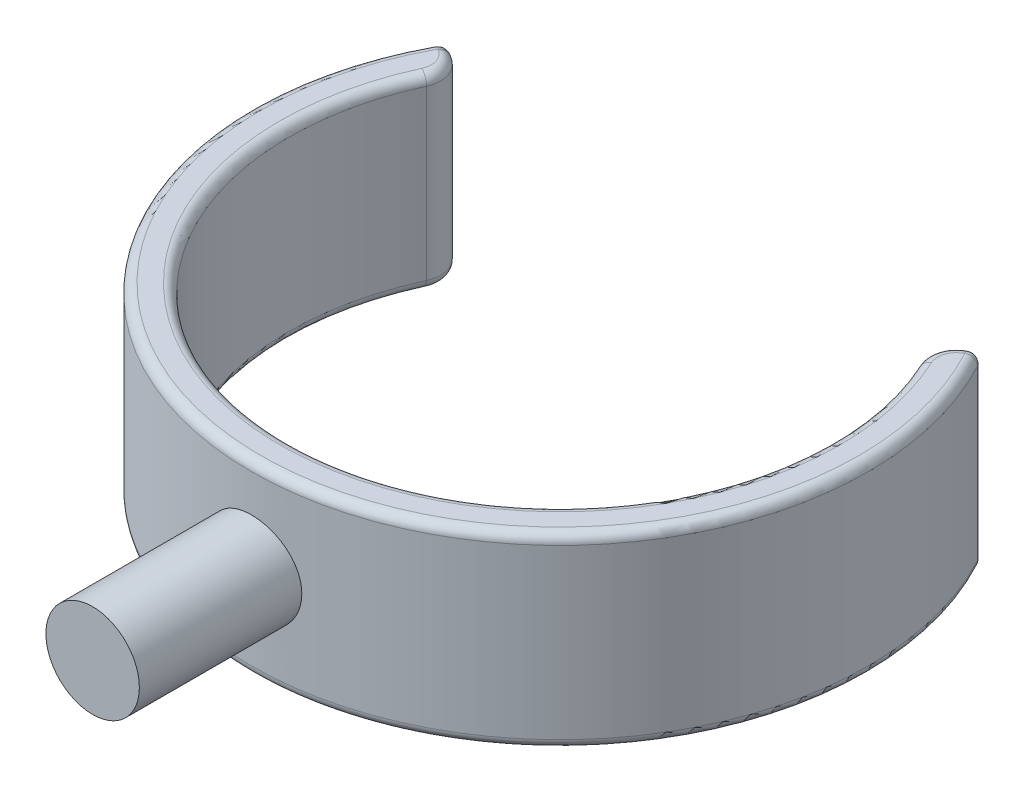
from build123d import *

# Parameters (mm, degrees)
EXTRUIR1_DEPTH      = 20
EXTRUIR2_REACH      = 102.774
EXTRUIR2_END_RADIUS = 33
EXTRUIR2_START      = 50
CROQUIS2_R          = 5
REDONDEO1_R         = 3
REDONDEO2_R         = 1


with BuildPart() as part:
    # Croquis1 → Extruir1 (new body)
    with BuildSketch(Plane(origin=(0, 0, 0), x_dir=(1, 0, 0), z_dir=(0, 1, 0))):
        with BuildLine():
            Line((28.578838325, 16.5), (25.11473671, 14.5))
            ThreePointArc((25.11473671, 14.5), (0, -29), (-25.11473671, 14.5))
            Line((-25.11473671, 14.5), (-28.578838325, 16.5))
            ThreePointArc((-28.578838325, 16.5), (0, -33), (28.578838325, 16.5))
        make_face()
    extrude(amount=EXTRUIR1_DEPTH)

    # Extruir2: up to this cylinder (the profile starts outside it)
    extruir2_end = Plane(origin=(0, 10, 0), z_dir=(0, -1, 0)) * Cylinder(EXTRUIR2_END_RADIUS, 272.548, mode=Mode.PRIVATE)
    # Croquis2 → Extruir2 (add, up to the surface)
    with BuildSketch(Plane.XY.offset(EXTRUIR2_START), mode=Mode.PRIVATE) as extruir2_sk1:
        with Locations((0, 10)):
            Circle(CROQUIS2_R)
    extruir2_tool1 = extrude(extruir2_sk1.sketch, amount=-EXTRUIR2_REACH, mode=Mode.PRIVATE) - extruir2_end
    add(extruir2_tool1.solids().sort_by_distance((0, 10, 50))[0])

    # Redondeo1
    redondeo1_edges = [part.edges().sort_by_distance(p)[0] for p in [
        (25.11473671, 10, -14.5),
        (-25.11473671, 10, -14.5),
    ]]
    fillet(redondeo1_edges, radius=REDONDEO1_R)

    # Redondeo2
    redondeo2_edges = [part.edges().sort_by_distance(p)[0] for p in [
        (0, 20, 33),
        (-28.084798824, 0, -16.214766161),
        (-28.084798824, 20, -16.214766161),
        (0, 0, 29),
        (28.084798824, 0, -16.214766161),
        (26.232610791, 0, -14.243040978),
        (-26.232610791, 0, -14.243040978),
        (0, 20, 29),
        (28.084798824, 20, -16.214766161),
        (26.232610791, 20, -14.243040978),
        (-26.232610791, 20, -14.243040978),
        (0, 0, 33),
        (28.578838325, 10, -16.5),
        (-28.578838325, 10, -16.5),
    ]]
    fillet(redondeo2_edges, radius=REDONDEO2_R)


solid = part.part
